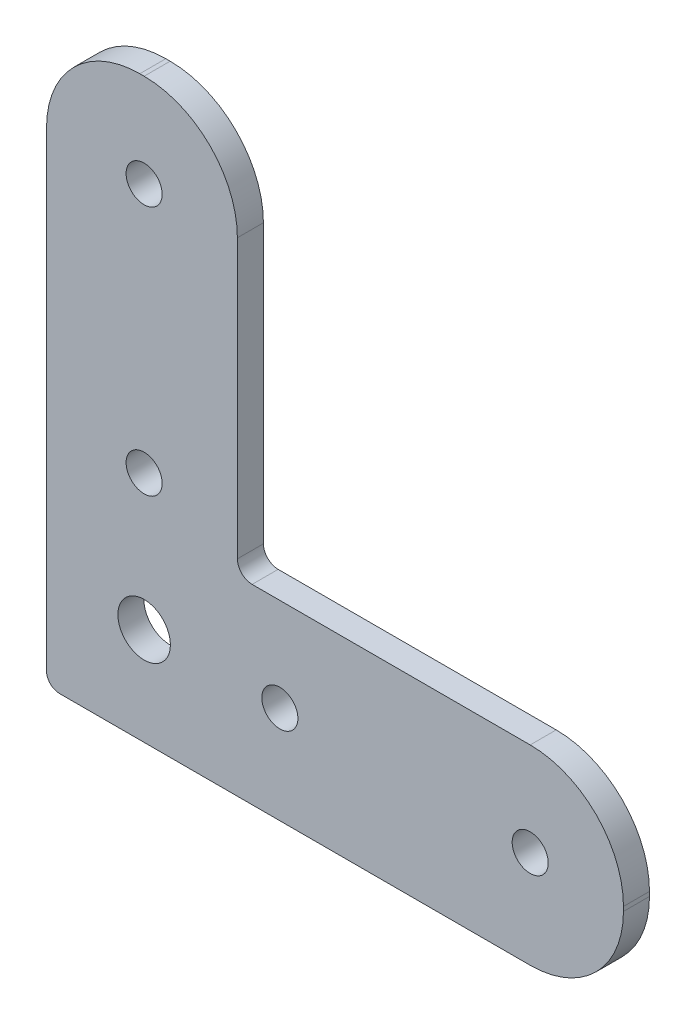
from build123d import *

# Parameters (mm, degrees)
BOSS_EXTRUDE1_DEPTH      = 3
FILLET4_R                = 21.5
FILLET5_R                = 3.4
FILLET6_R                = 3
F_5_16_CLEARANCE_HOLE1_D = 8.3185
M12_CLEARANCE_HOLE1_D    = 12.1


with BuildPart() as part:
    # Sketch1 → Boss-Extrude1 (new, symmetric)
    with BuildSketch(Plane.XY):
        Polygon((0, 133), (0, 0), (133, 0), (133, 44), (44, 44), (44, 133), align=None)
    extrude(amount=BOSS_EXTRUDE1_DEPTH, both=True)

    # Fillet4
    fillet4_edges = [part.edges().sort_by_distance(p)[0] for p in [
        (133, 44, 0),
        (133, 0, 0),
        (0, 133, 0),
        (44, 133, 0),
    ]]
    fillet(fillet4_edges, radius=FILLET4_R)

    # Fillet5
    fillet5_edges = [part.edges().sort_by_distance(p)[0] for p in [
        (44, 44, 0),
    ]]
    fillet(fillet5_edges, radius=FILLET5_R)

    # Fillet6
    fillet6_edges = [part.edges().sort_by_distance(p)[0] for p in [
        (0, 0, 0),
    ]]
    fillet(fillet6_edges, radius=FILLET6_R)

    # 5/16 Clearance Hole1 (through all)
    with Locations(Plane.XY.offset(3)):
        with Locations((22.5, 111.5), (22.5, 53.7884), (53.7884, 22.5), (111.5, 22.5)):
            Hole(F_5_16_CLEARANCE_HOLE1_D / 2)

    # M12 Clearance Hole1 (through all)
    with Locations(Plane.XY.offset(3)):
        with Locations((22.5, 22.5)):
            Hole(M12_CLEARANCE_HOLE1_D / 2)


solid = part.part
